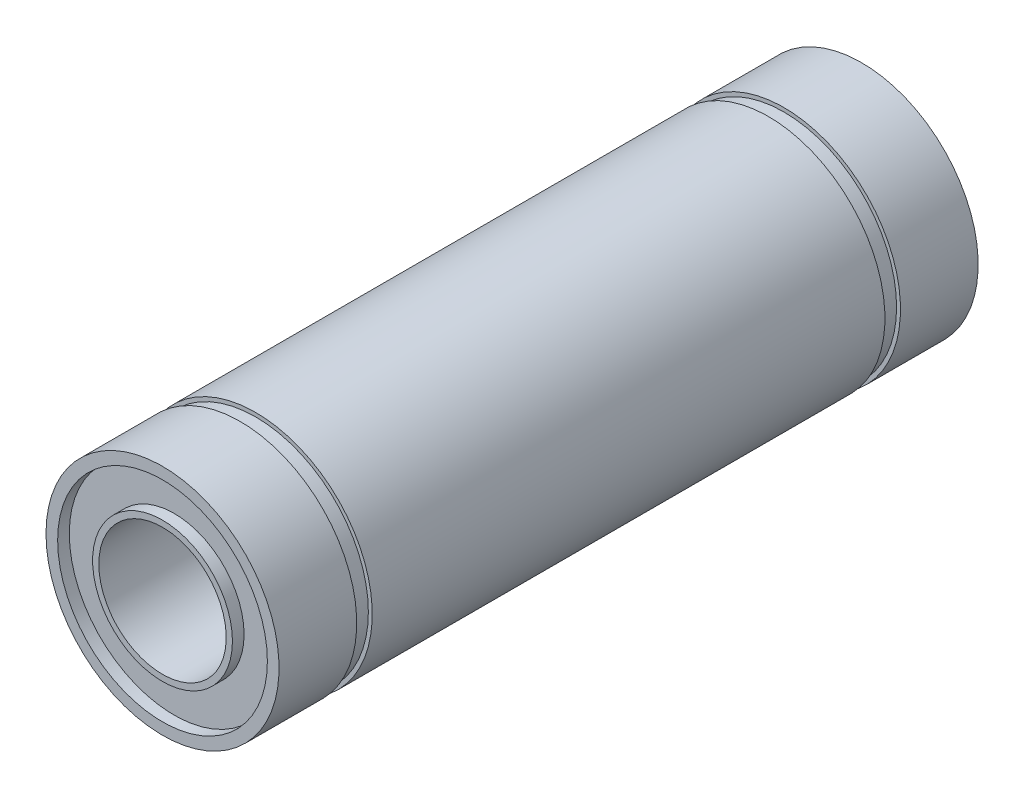
from build123d import *

# Parameters (mm, degrees)
SKETCH1_R           = 7.5
SKETCH1_R_2         = 4.1
BOSS_EXTRUDE1_DEPTH = 45
SKETCH2_R           = 6.75
SKETCH2_R_2         = 4.5
CUT_EXTRUDE2_DEPTH  = 0.75
CUT_EXTRUDE3_START  = -0.75
SKETCH3_R           = 7
SKETCH3_R_2         = 4.5
CUT_EXTRUDE3_DEPTH  = 0.75
SKETCH4_W           = 0.25
SKETCH4_H           = 1
SKETCH5_W           = 0.25
SKETCH5_H           = 1


with BuildPart() as part:
    # Sketch1 → Boss-Extrude1 (new body)
    with BuildSketch(Plane.XY):
        with Locations(Location((0, 0, 0), (0, 0, 180))):
            Circle(SKETCH1_R)
        with Locations(Location((0, 0, 0), (0, 0, 180))):
            Circle(SKETCH1_R_2, mode=Mode.SUBTRACT)
    extrude(amount=BOSS_EXTRUDE1_DEPTH)

    # Sketch2 → Cut-Extrude2 (cut)
    with BuildSketch(Plane.XY.offset(45)):
        Circle(SKETCH2_R)
        Circle(SKETCH2_R_2, mode=Mode.SUBTRACT)
    extrude(amount=-CUT_EXTRUDE2_DEPTH, mode=Mode.SUBTRACT)

    # Sketch3 → Cut-Extrude3 (cut)
    with BuildSketch(Plane(origin=(0, 0, 0), x_dir=(-1, 0, 0), z_dir=(0, 0, -1)).offset(CUT_EXTRUDE3_START)):
        Circle(SKETCH3_R)
        with Locations(Location((0, 0, 0), (0, 0, 180))):
            Circle(SKETCH3_R_2, mode=Mode.SUBTRACT)
    extrude(amount=CUT_EXTRUDE3_DEPTH, mode=Mode.SUBTRACT)

    # Sketch4 → Cut-Revolve1 (revolve, cut)
    with BuildSketch(Plane(origin=(0, 0, 0), x_dir=(1, 0, 0), z_dir=(0, 1, 0))):
        with Locations((-7.375, -39.5)):
            Rectangle(SKETCH4_W, SKETCH4_H)
    revolve(axis=Axis((0, 0, 45), (0, 0, -1)), mode=Mode.SUBTRACT)

    # Sketch5 → Cut-Revolve2 (revolve, cut)
    with BuildSketch(Plane(origin=(0, 0, 0), x_dir=(1, 0, 0), z_dir=(0, 1, 0))):
        with Locations((-7.375, -5.5)):
            Rectangle(SKETCH5_W, SKETCH5_H)
    revolve(axis=Axis((0, 0, 45), (0, 0, -1)), mode=Mode.SUBTRACT)


solid = part.part
